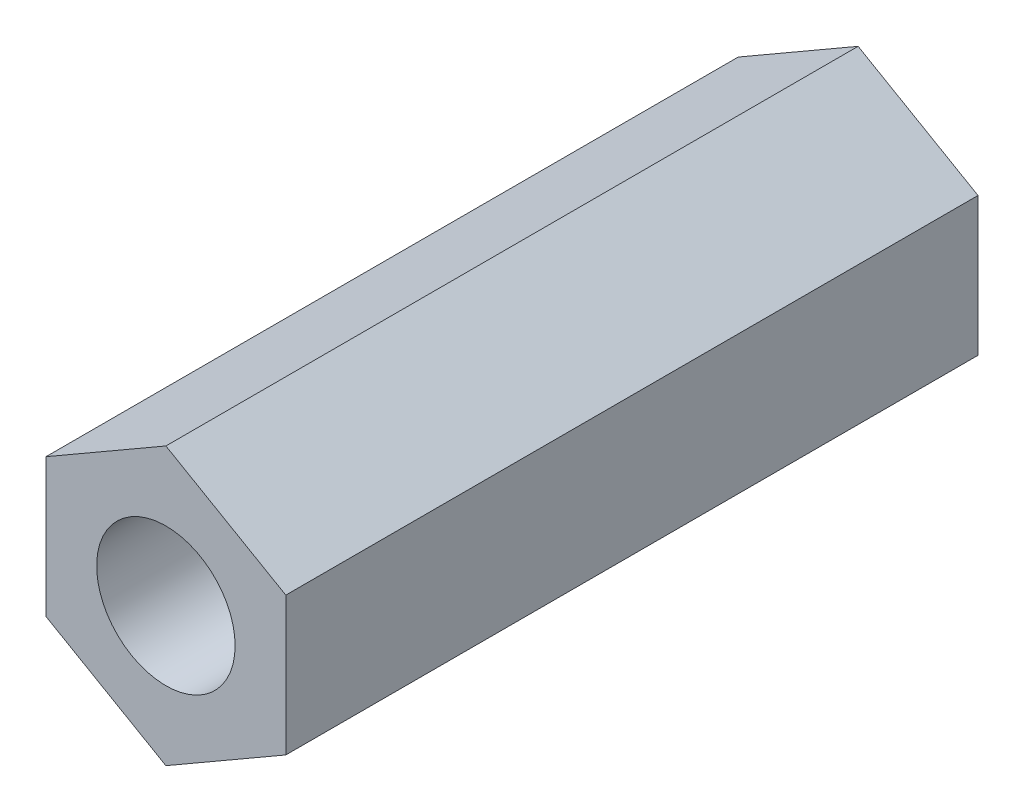
from build123d import *

# Parameters (mm, degrees)
SKETCH1_R           = 0.25
BOSS_EXTRUDE1_DEPTH = 2.5


with BuildPart() as part:
    # Sketch1 → Boss-Extrude1 (new body)
    with BuildSketch(Plane.XY):
        Polygon((0, 0.5), (-0.433012702, 0.25), (-0.433012702, -0.25), (0, -0.5), (0.433012702, -0.25), (0.433012702, 0.25), align=None)
        Circle(SKETCH1_R, mode=Mode.SUBTRACT)
    extrude(amount=BOSS_EXTRUDE1_DEPTH)


solid = part.part
